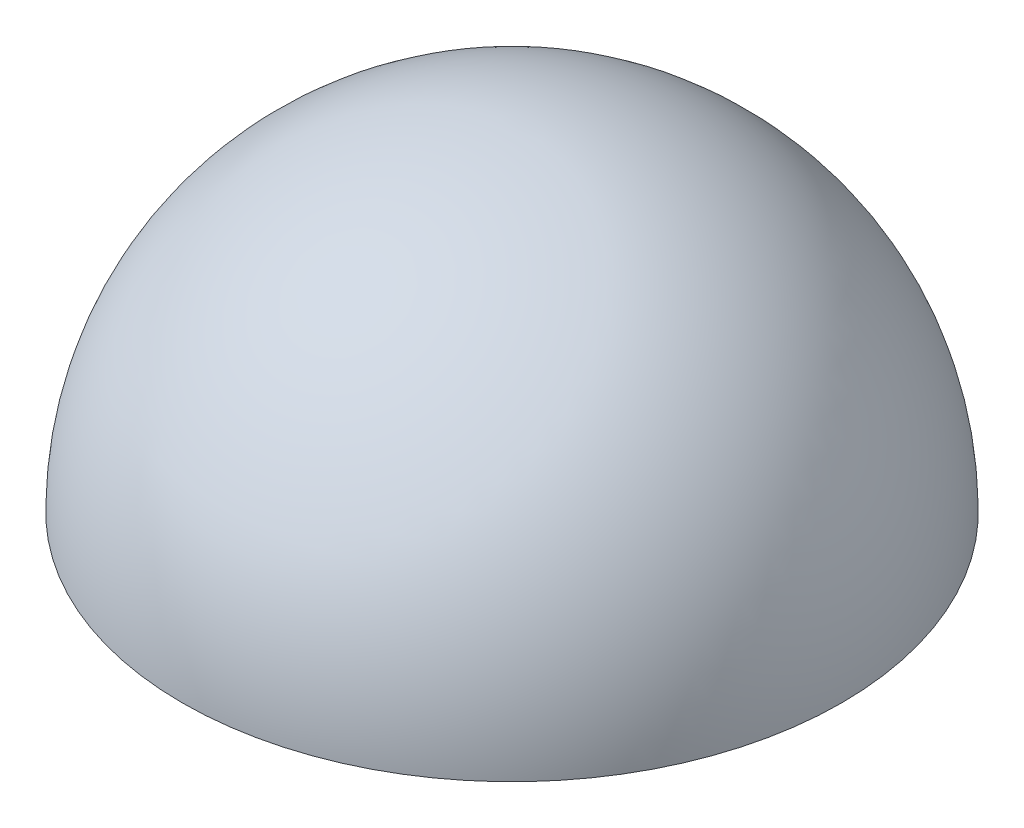
from build123d import *

# Parameters (mm, degrees)
SKETCH_2_R          = 46.183370151
CUT_EXTRUDE_1_DEPTH = 500


with BuildPart() as part:
    # 草图1 → 旋转1 (revolve)
    with BuildSketch(Plane.XY):
        with BuildLine():
            Line((0, 40), (0, 37.5))
            ThreePointArc((0, 37.5), (37.5, 0), (0, -37.5))
            Line((0, -37.5), (0, -40))
            ThreePointArc((0, -40), (40, 0), (0, 40))
        make_face()
    revolve(axis=Axis((0, 40, 0), (0, -1, 0)))

    # 草图2 → 切除-拉伸1 (cut)
    with BuildSketch(Plane(origin=(0, 0, 0), x_dir=(1, 0, 0), z_dir=(0, 1, 0))):
        Circle(SKETCH_2_R)
    extrude(amount=-CUT_EXTRUDE_1_DEPTH, mode=Mode.SUBTRACT)


solid = part.part
